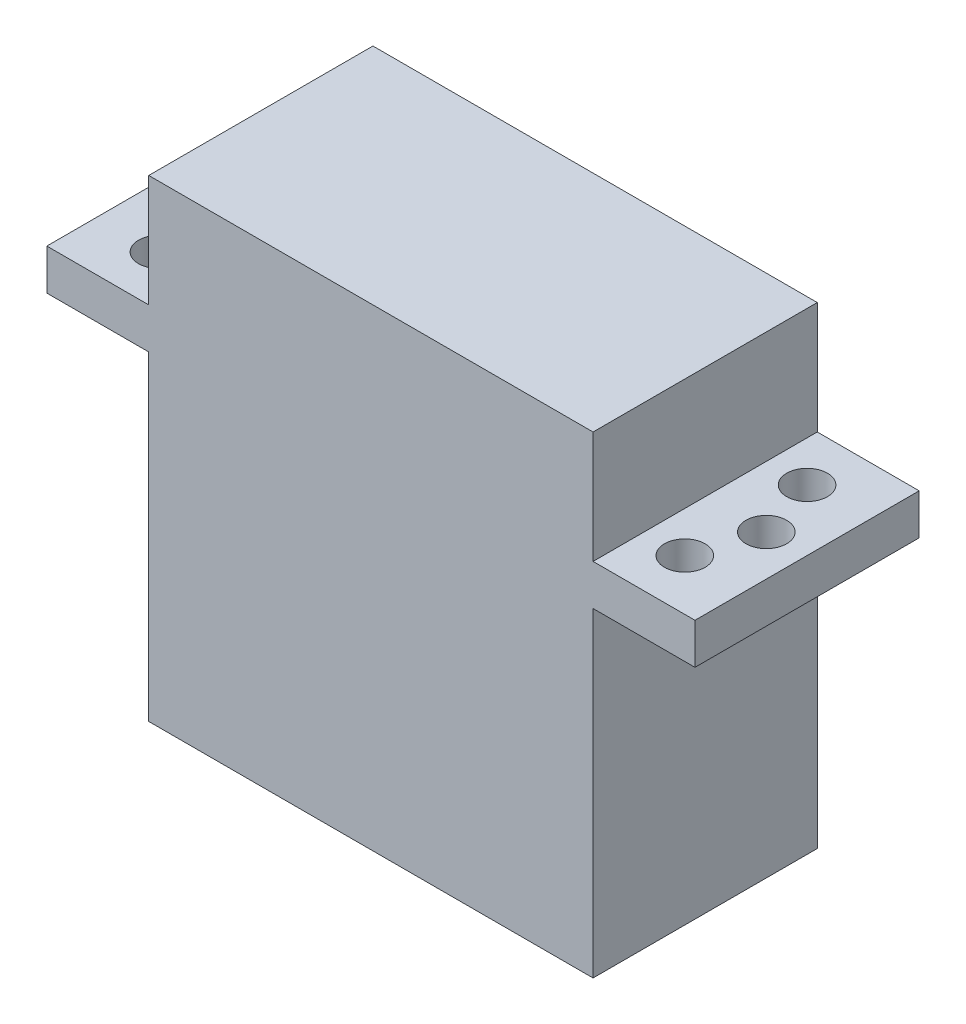
from build123d import *

# Parameters (mm, degrees)
SKETCH1_W           = 21.8
SKETCH1_H           = 23.2
BOSS_EXTRUDE1_DEPTH = 5.5
BOSS_EXTRUDE2_START = -5.5
SKETCH2_W           = 31.8
SKETCH2_H           = 11
BOSS_EXTRUDE2_DEPTH = 2
SKETCH3_R           = 1
CUT_EXTRUDE1_DEPTH  = 25.420278459


with BuildPart() as part:
    # Sketch1 → Boss-Extrude1 (new, symmetric)
    with BuildSketch(Plane.XY):
        Rectangle(SKETCH1_W, SKETCH1_H)
    extrude(amount=BOSS_EXTRUDE1_DEPTH, both=True)

    # Sketch2 → Boss-Extrude2 (add)
    with BuildSketch(Plane(origin=(0, 11.6, 0), x_dir=(1, 0, 0), z_dir=(0, 1, 0)).offset(BOSS_EXTRUDE2_START)):
        Rectangle(SKETCH2_W, SKETCH2_H)
    extrude(amount=-BOSS_EXTRUDE2_DEPTH)

    # Sketch3 → Cut-Extrude1 (cut, through all)
    with BuildSketch(Plane(origin=(0, 6.1, 0), x_dir=(1, 0, 0), z_dir=(0, 1, 0))):
        with Locations(Location((-13.9, 0, 0), (0, 0, 180))):
            Circle(SKETCH3_R)
        with Locations(Location((-12.9, 3, 0), (0, 0, 180))):
            Circle(SKETCH3_R)
        with Locations(Location((-12.9, -3, 0), (0, 0, 180))):
            Circle(SKETCH3_R)
        with Locations(Location((12.9, -3, 0), (0, 0, 180))):
            Circle(SKETCH3_R)
        with Locations(Location((12.9, 3, 0), (0, 0, 180))):
            Circle(SKETCH3_R)
        with Locations(Location((13.9, 0, 0), (0, 0, 180))):
            Circle(SKETCH3_R)
    extrude(amount=-CUT_EXTRUDE1_DEPTH, mode=Mode.SUBTRACT)


solid = part.part
